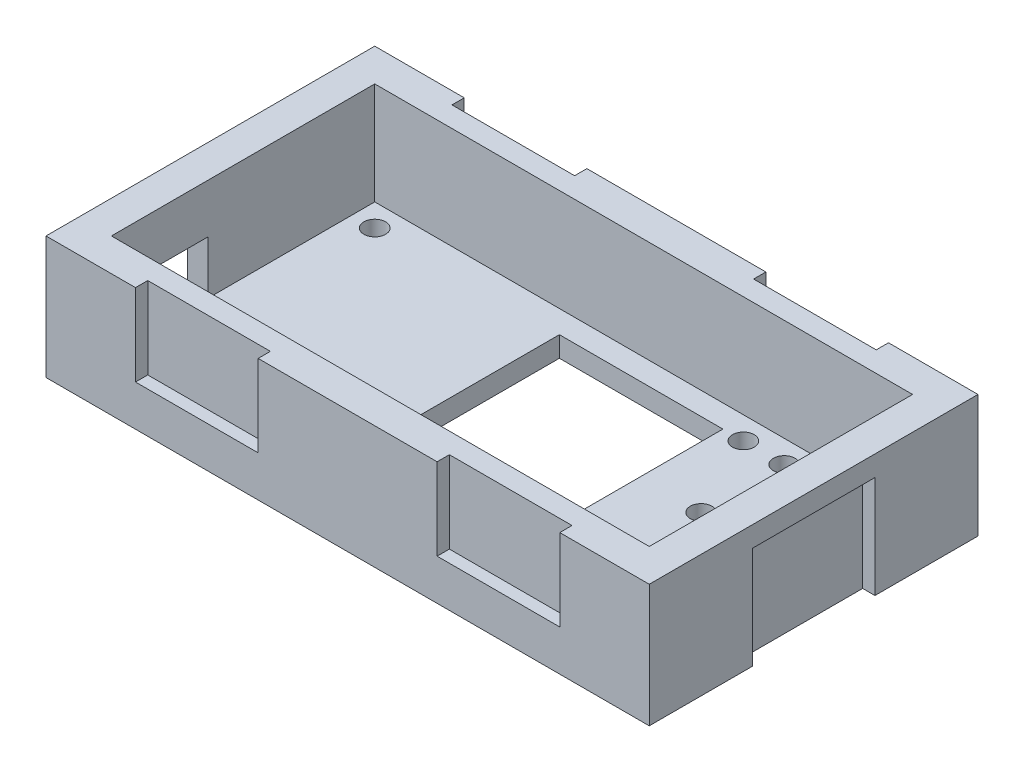
from build123d import *

# Parameters (mm, degrees)
SKETCH1_W                  = 147.57
SKETCH1_H                  = 80.42
BOSS_EXTRUDE1_DEPTH        = 30
SKETCH2_W                  = 131.57
SKETCH2_H                  = 64.42
CUT_EXTRUDE1_DEPTH         = 25
F_4_0_209_DIAMETER_HOLE1_D = 5.3086
SKETCH13_W                 = 30
SKETCH13_H                 = 20
CUT_EXTRUDE3_DEPTH         = 3
MIRROR3_COPY_1_SKETCH_W    = 30
MIRROR3_COPY_1_SKETCH_H    = 20
MIRROR3_COPY_1_DEPTH       = 3
SKETCH19_W                 = 30
SKETCH19_H                 = 25
CUT_EXTRUDE4_DEPTH         = 3
SKETCH25_W                 = 40
SKETCH25_H                 = 53.34
CUT_EXTRUDE5_DEPTH         = 170.909626861
SKETCH30_W                 = 20
SKETCH30_H                 = 12
CUT_EXTRUDE7_DEPTH         = 164.851033869


with BuildPart() as part:
    # Sketch1 → Boss-Extrude1 (new body)
    with BuildSketch(Plane(origin=(0, 0, 0), x_dir=(1, 0, 0), z_dir=(0, 1, 0))):
        with Locations((73.785, 40.21)):
            Rectangle(SKETCH1_W, SKETCH1_H)
    extrude(amount=BOSS_EXTRUDE1_DEPTH)

    # Sketch2 → Cut-Extrude1 (cut)
    with BuildSketch(Plane(origin=(0, 30, 0), x_dir=(1, 0, 0), z_dir=(0, 1, 0))):
        with Locations((73.785, 40.21)):
            Rectangle(SKETCH2_W, SKETCH2_H)
    extrude(amount=-CUT_EXTRUDE1_DEPTH, mode=Mode.SUBTRACT)

    # #4 (0.209) Diameter Hole1 (through all)
    with Locations(Plane(origin=(13.54, 5, -66.88), x_dir=(0, 0, 1), z_dir=(0, 1, 0))):
        with Locations((0, 0), (53.34, 0), (53.34, 90.17), (53.34, 100.17), (38.1, 100.17), (38.1, 115.41), (53.34, 115.41), (20.32, 120.49), (0, 120.49), (0, 100.17), (20.32, 100.17), (0, 90.17)):
            Hole(F_4_0_209_DIAMETER_HOLE1_D / 2)

    # Sketch13 → Cut-Extrude3 (cut)
    with BuildSketch(Plane(origin=(0, 0, -80.42), x_dir=(-1, 0, 0), z_dir=(0, 0, -1))):
        with Locations((-110.6775, 20)):
            Rectangle(SKETCH13_W, SKETCH13_H)
    cut_extrude3 = extrude(amount=-CUT_EXTRUDE3_DEPTH, mode=Mode.SUBTRACT)

    # Mirror2: Cut-Extrude3 across plane
    add(cut_extrude3.mirror(Plane(origin=(73.785, 0, 0), x_dir=(0, 0, 1), z_dir=(1, 0, 0))), mode=Mode.SUBTRACT)

    # Mirror3: Cut-Extrude3 across plane
    add(cut_extrude3.mirror(Plane(origin=(0, 0, -40.21), x_dir=(1, 0, 0), z_dir=(0, 0, -1))), mode=Mode.SUBTRACT)

    # Mirror3 copy 1 sketch → Mirror3 copy 1 (cut)
    with BuildSketch(Plane(origin=(147.57, 0, 0), x_dir=(1, 0, 0), z_dir=(0, 0, 1))):
        with Locations((-110.6775, 20)):
            Rectangle(MIRROR3_COPY_1_SKETCH_W, MIRROR3_COPY_1_SKETCH_H)
    extrude(amount=-MIRROR3_COPY_1_DEPTH, mode=Mode.SUBTRACT)

    # Sketch19 → Cut-Extrude4 (cut)
    with BuildSketch(Plane.ZY):
        with Locations((-40.21, 12.5)):
            Rectangle(SKETCH19_W, SKETCH19_H)
    cut_extrude4 = extrude(amount=-CUT_EXTRUDE4_DEPTH, mode=Mode.SUBTRACT)

    # Mirror7: Cut-Extrude4 across plane
    add(cut_extrude4.mirror(Plane(origin=(73.785, 0, 0), x_dir=(0, 0, 1), z_dir=(1, 0, 0))), mode=Mode.SUBTRACT)

    # Sketch25 → Cut-Extrude5 (cut, through all)
    with BuildSketch(Plane(origin=(0, 5, 0), x_dir=(1, 0, 0), z_dir=(0, 1, 0))):
        with Locations((78.71, 40.21)):
            Rectangle(SKETCH25_W, SKETCH25_H)
    extrude(amount=-CUT_EXTRUDE5_DEPTH, mode=Mode.SUBTRACT)

    # Sketch30 → Cut-Extrude7 (cut, through all)
    with BuildSketch(Plane(origin=(8, 0, 0), x_dir=(0, 0, -1), z_dir=(1, 0, 0))):
        with Locations((21.605, 12)):
            Rectangle(SKETCH30_W, SKETCH30_H)
    extrude(amount=-CUT_EXTRUDE7_DEPTH, mode=Mode.SUBTRACT)


solid = part.part
